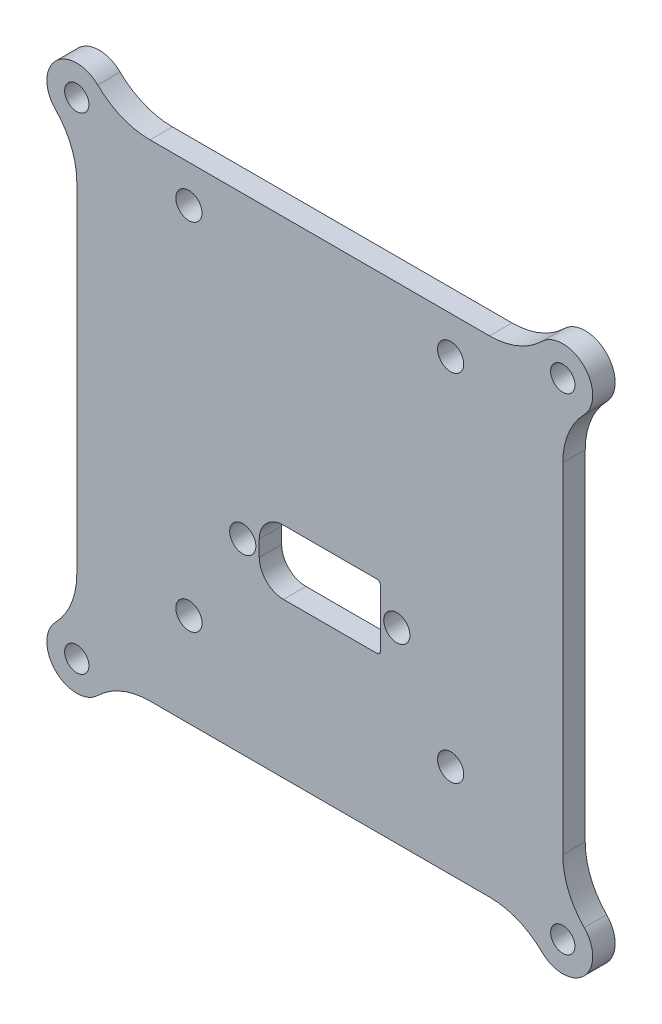
from build123d import *

# Parameters (mm, degrees)
SKETCH_1_R          = 1.625
EXTRUDE_1_DEPTH     = 3
FILLET_1_R          = 10
SKETCH_3_R          = 1.75
CUT_EXTRUDE_1_DEPTH = 10
SKETCH_4_R          = 1.75
CUT_EXTRUDE_2_DEPTH = 10
SKETCH_5_R          = 1.75
CUT_EXTRUDE_3_DEPTH = 10
CUT_EXTRUDE_4_DEPTH = 10


with BuildPart() as part:
    # Эскиз1 → Бобышка-Вытянуть1 (new body)
    with BuildSketch(Plane.XY):
        with BuildLine():
            ThreePointArc((-32.5, -28.5), (-35.328427125, -35.328427125), (-28.5, -32.5))
            Line((-28.5, -32.5), (28.5, -32.5))
            ThreePointArc((28.5, -32.5), (35.328427125, -35.328427125), (32.5, -28.5))
            Line((32.5, -28.5), (32.5, 28.5))
            ThreePointArc((32.5, 28.5), (35.328427125, 35.328427125), (28.5, 32.5))
            Line((28.5, 32.5), (-28.5, 32.5))
            ThreePointArc((-28.5, 32.5), (-35.328427125, 35.328427125), (-32.5, 28.5))
            Line((-32.5, 28.5), (-32.5, -28.5))
        make_face()
        with Locations((-32.5, -32.5)):
            Circle(SKETCH_1_R, mode=Mode.SUBTRACT)
        with Locations((32.5, 32.5)):
            Circle(SKETCH_1_R, mode=Mode.SUBTRACT)
        with Locations((-32.5, 32.5)):
            Circle(SKETCH_1_R, mode=Mode.SUBTRACT)
        with Locations((32.5, -32.5)):
            Circle(SKETCH_1_R, mode=Mode.SUBTRACT)
    extrude(amount=EXTRUDE_1_DEPTH)

    # Скругление1
    fillet_1_edges = [part.edges().sort_by_distance(p)[0] for p in [
        (-32.5, -28.5, 1.5),
        (-32.5, 28.5, 1.5),
        (-28.5, 32.5, 1.5),
        (28.5, 32.5, 1.5),
        (32.5, 28.5, 1.5),
        (32.5, -28.5, 1.5),
        (28.5, -32.5, 1.5),
        (-28.5, -32.5, 1.5),
    ]]
    fillet(fillet_1_edges, radius=FILLET_1_R)

    # Эскиз3 → Вырез-Вытянуть1 (cut)
    with BuildSketch(Plane(origin=(0, 0, 0), x_dir=(-1, 0, 0), z_dir=(0, 0, -1))):
        with Locations((-17.5, 27.5)):
            Circle(SKETCH_3_R)
        with Locations(Location((17.5, 27.5, 0), (0, 0, 180))):
            Circle(SKETCH_3_R)
    extrude(amount=-CUT_EXTRUDE_1_DEPTH, mode=Mode.SUBTRACT)

    # Эскиз4 → Вырез-Вытянуть2 (cut)
    with BuildSketch(Plane(origin=(0, 0, 0), x_dir=(-1, 0, 0), z_dir=(0, 0, -1))):
        with Locations((-17.5, -20)):
            Circle(SKETCH_4_R)
        with Locations(Location((17.5, -20, 0), (0, 0, 180))):
            Circle(SKETCH_4_R)
    extrude(amount=-CUT_EXTRUDE_2_DEPTH, mode=Mode.SUBTRACT)

    # Эскиз5 → Вырез-Вытянуть3 (cut)
    with BuildSketch(Plane(origin=(0, 0, 0), x_dir=(-1, 0, 0), z_dir=(0, 0, -1))):
        with Locations((-10.3, -7.5)):
            Circle(SKETCH_5_R)
        with Locations(Location((10.3, -7.5, 0), (0, 0, 180))):
            Circle(SKETCH_5_R)
    extrude(amount=-CUT_EXTRUDE_3_DEPTH, mode=Mode.SUBTRACT)

    # Эскиз7 → Вырез-Вытянуть4 (cut)
    # profile 1 of 2: a face of its own
    with BuildSketch(Plane(origin=(0, 0, 0), x_dir=(-1, 0, 0), z_dir=(0, 0, -1))):
        with BuildLine():
            Line((-7.65, -3.2), (4.85, -3.2))
            ThreePointArc((4.85, -3.2), (7.148097039, -4.151902961), (8.1, -6.45))
            Line((8.1, -6.45), (8.1, -8.55))
            ThreePointArc((8.1, -8.55), (7.148097039, -10.848097039), (4.85, -11.8))
            Line((4.85, -11.8), (-7.65, -11.8))
            ThreePointArc((-7.65, -11.8), (-7.968198052, -11.668198052), (-8.1, -11.35))
            Line((-8.1, -11.35), (-8.1, -3.65))
            ThreePointArc((-8.1, -3.65), (-7.968198052, -3.331801948), (-7.65, -3.2))
        make_face()
        with BuildLine():
            ThreePointArc((-7.85, -11.35), (-7.791421356, -11.491421356), (-7.65, -11.55))
            Line((-7.65, -11.55), (4.85, -11.55))
            ThreePointArc((4.85, -11.55), (6.971320344, -10.671320344), (7.85, -8.55))
            Line((7.85, -8.55), (7.85, -6.45))
            ThreePointArc((7.85, -6.45), (6.971320344, -4.328679656), (4.85, -3.45))
            Line((4.85, -3.45), (-7.65, -3.45))
            ThreePointArc((-7.65, -3.45), (-7.791421356, -3.508578644), (-7.85, -3.65))
            Line((-7.85, -3.65), (-7.85, -11.35))
        make_face(mode=Mode.SUBTRACT)
    # profile 2 of 2: a face of its own
    with BuildSketch(Plane(origin=(0, 0, 0), x_dir=(-1, 0, 0), z_dir=(0, 0, -1))):
        with BuildLine():
            Line((-7.85, -3.65), (-7.85, -11.35))
            ThreePointArc((-7.85, -11.35), (-7.791421356, -11.491421356), (-7.65, -11.55))
            Line((-7.65, -11.55), (4.85, -11.55))
            ThreePointArc((4.85, -11.55), (6.971320344, -10.671320344), (7.85, -8.55))
            Line((7.85, -8.55), (7.85, -6.45))
            ThreePointArc((7.85, -6.45), (6.971320344, -4.328679656), (4.85, -3.45))
            Line((4.85, -3.45), (-7.65, -3.45))
            ThreePointArc((-7.65, -3.45), (-7.791421356, -3.508578644), (-7.85, -3.65))
        make_face()
    extrude(amount=-CUT_EXTRUDE_4_DEPTH, mode=Mode.SUBTRACT)


solid = part.part
